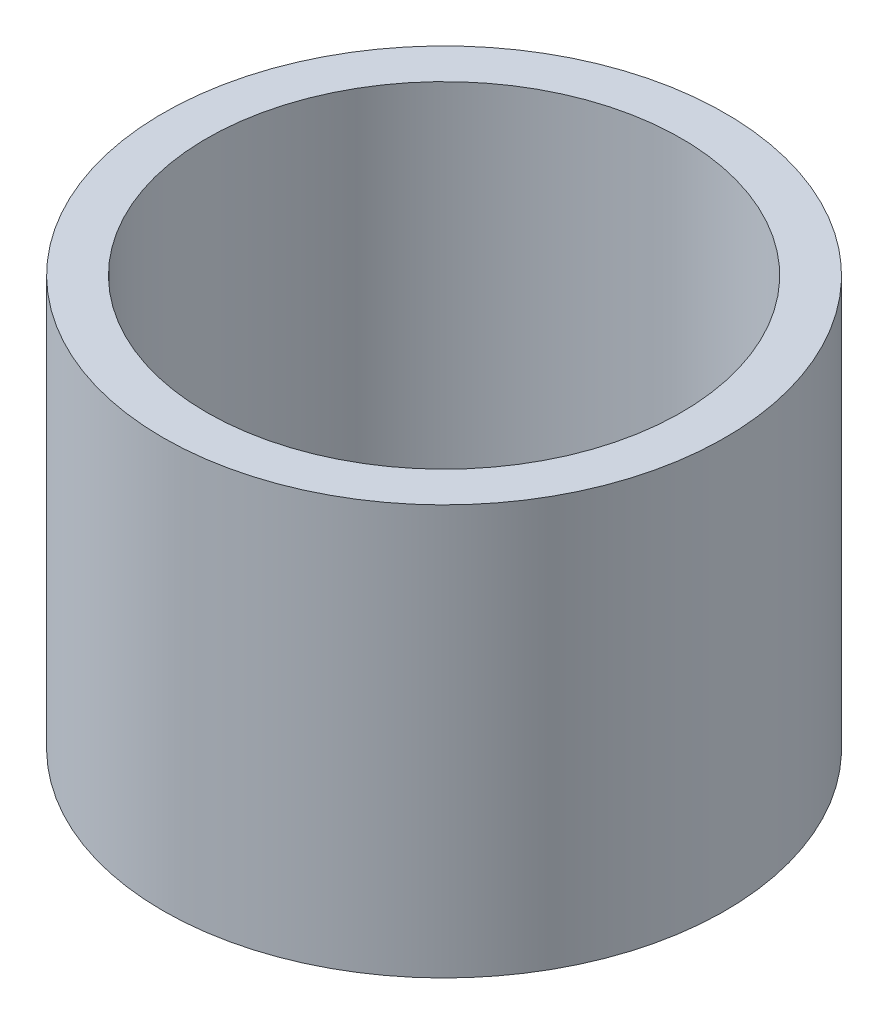
from build123d import *

# Parameters (mm, degrees)
SKETCH1_R           = 28.575
BOSS_EXTRUDE1_DEPTH = 41.656
SKETCH2_R           = 24.13
CUT_EXTRUDE1_DEPTH  = 35.26536


with BuildPart() as part:
    # Sketch1 → Boss-Extrude1 (new body)
    with BuildSketch(Plane(origin=(0, 0, 0), x_dir=(1, 0, 0), z_dir=(0, 1, 0))):
        with Locations(Location((0, 0, 0), (0, 0, 270))):
            Circle(SKETCH1_R)
    extrude(amount=BOSS_EXTRUDE1_DEPTH)

    # Sketch2 → Cut-Extrude1 (cut)
    with BuildSketch(Plane(origin=(0, 41.656, 0), x_dir=(1, 0, 0), z_dir=(0, 1, 0))):
        with Locations(Location((0, 0, 0), (0, 0, 270))):
            Circle(SKETCH2_R)
    extrude(amount=-CUT_EXTRUDE1_DEPTH, mode=Mode.SUBTRACT)


solid = part.part
